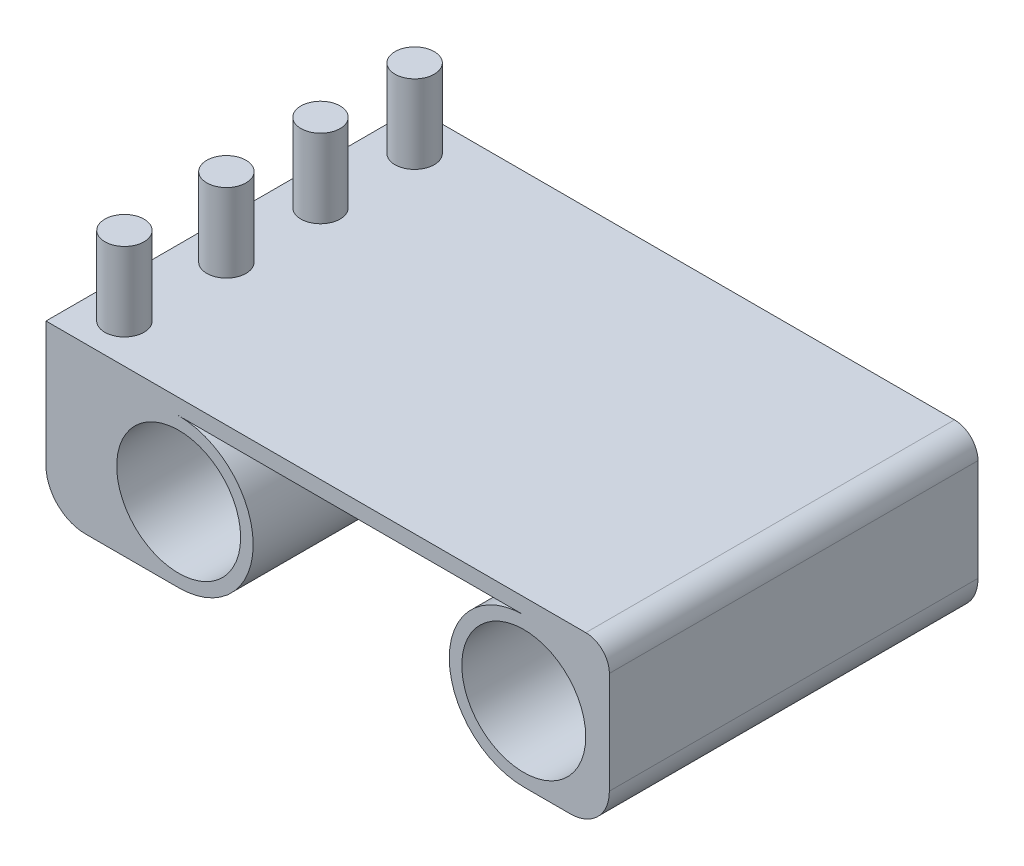
from build123d import *

# Parameters (mm, degrees)
ESQUISSE1_R             = 7.9
BOSS_EXTRU_1_DEPTH      = 47
CONG_1_R                = 5
CONG_2_R                = 5
CONG_4_R                = 3
ESQUISSE2_R             = 2.5
BOSS_EXTRU_2_DEPTH      = 10
ESQUISSE3_R             = 1.5
ENL_V_MAT_EXTRU_1_DEPTH = 6


with BuildPart() as part:
    # Esquisse1 → Boss.-Extru.1 (new body)
    with BuildSketch(Plane.XY):
        with BuildLine():
            ThreePointArc((5.270999392, 0), (14.770999392, 9.5), (5.270999392, 19))
            Line((5.270999392, 19), (49.270999392, 19))
            ThreePointArc((49.270999392, 19), (39.770999392, 9.5), (49.270999392, 0))
            Line((49.270999392, 0), (60.184195152, 0))
            Line((60.184195152, 0), (60.184195152, 21))
            Line((60.184195152, 21), (-11.642273667, 21))
            Line((-11.642273667, 21), (-11.642273667, 0))
            Line((-11.642273667, 0), (5.270999392, 0))
        make_face()
        with Locations((5.270999392, 9.5)):
            Circle(ESQUISSE1_R, mode=Mode.SUBTRACT)
        with Locations((49.270999392, 9.5)):
            Circle(ESQUISSE1_R, mode=Mode.SUBTRACT)
    extrude(amount=BOSS_EXTRU_1_DEPTH)

    # Congé1
    cong_1_edges = [part.edges().sort_by_distance(p)[0] for p in [
        (-11.642273667, 0, 23.5),
    ]]
    fillet(cong_1_edges, radius=CONG_1_R)

    # Congé2
    cong_2_edges = [part.edges().sort_by_distance(p)[0] for p in [
        (60.184195152, 0, 23.5),
    ]]
    fillet(cong_2_edges, radius=CONG_2_R)

    # Congé4
    cong_4_edges = [part.edges().sort_by_distance(p)[0] for p in [
        (60.184195152, 21, 23.5),
    ]]
    fillet(cong_4_edges, radius=CONG_4_R)

    # Esquisse2 → Boss.-Extru.2 (add)
    with BuildSketch(Plane(origin=(0, 21, 0), x_dir=(1, 0, 0), z_dir=(0, 1, 0))):
        with Locations(Location((-6.642273667, -42, 0), (0, 0, 270))):
            Circle(ESQUISSE2_R)
        with Locations(Location((-6.642273667, -29, 0), (0, 0, 270))):
            Circle(ESQUISSE2_R)
        with Locations(Location((-6.642273667, -17, 0), (0, 0, 270))):
            Circle(ESQUISSE2_R)
        with Locations(Location((-6.642273667, -5, 0), (0, 0, 270))):
            Circle(ESQUISSE2_R)
    extrude(amount=BOSS_EXTRU_2_DEPTH)

    # Esquisse3 → Enlèv. mat.-Extru.1 (cut)
    with BuildSketch(Plane.ZY.offset(11.642273667)):
        with Locations((5, 26)):
            Circle(ESQUISSE3_R)
        with Locations((17, 26)):
            Circle(ESQUISSE3_R)
        with Locations((29, 26)):
            Circle(ESQUISSE3_R)
        with Locations((42, 26)):
            Circle(ESQUISSE3_R)
    extrude(amount=-ENL_V_MAT_EXTRU_1_DEPTH, mode=Mode.SUBTRACT)


solid = part.part
